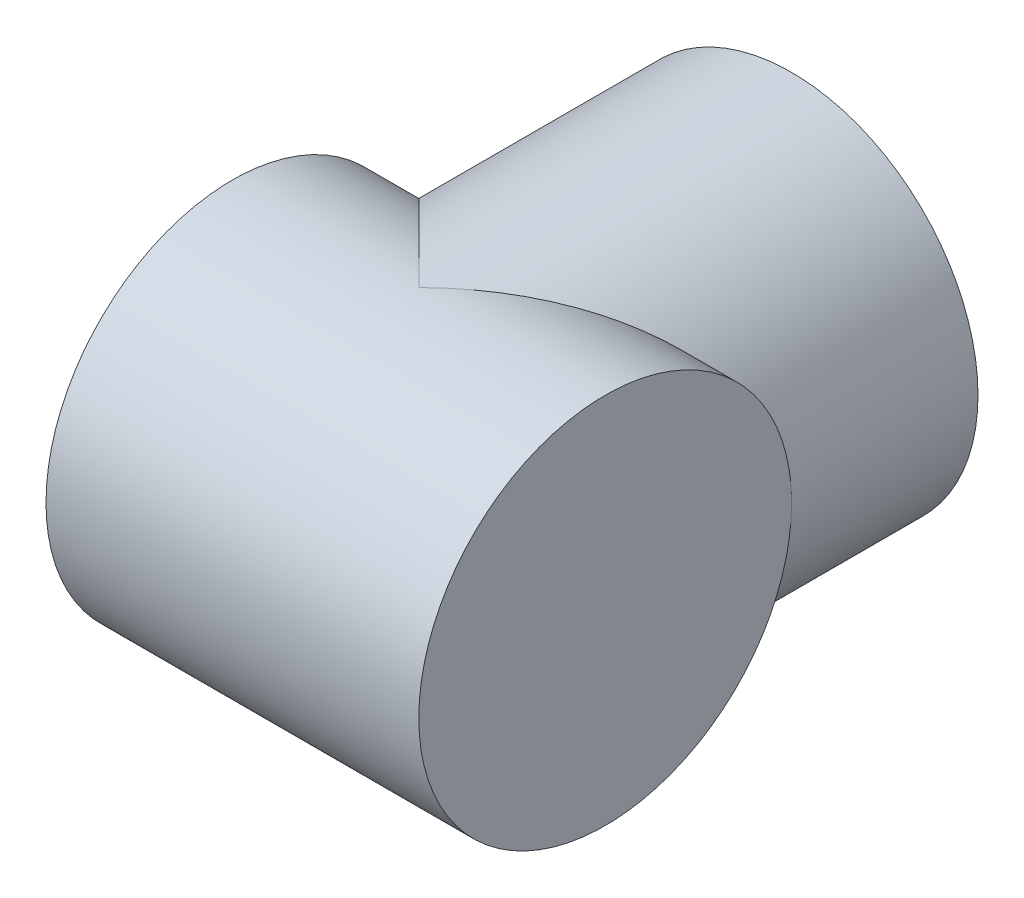
from build123d import *

# Parameters (mm, degrees)
SKETCH_1_R      = 150
EXTRUDE_1_DEPTH = 150
SKETCH_2_R      = 150
EXTRUDE_2_DEPTH = 300


with BuildPart() as part:
    # 草图1 → 凸台-拉伸1 (new, symmetric)
    with BuildSketch(Plane(origin=(0, 0, 0), x_dir=(0, 0, -1), z_dir=(1, 0, 0))):
        Circle(SKETCH_1_R)
    extrude(amount=EXTRUDE_1_DEPTH, both=True)

    # 草图2 → 凸台-拉伸2 (add)
    with BuildSketch(Plane.XY):
        Circle(SKETCH_2_R)
    extrude(amount=-EXTRUDE_2_DEPTH)


solid = part.part
